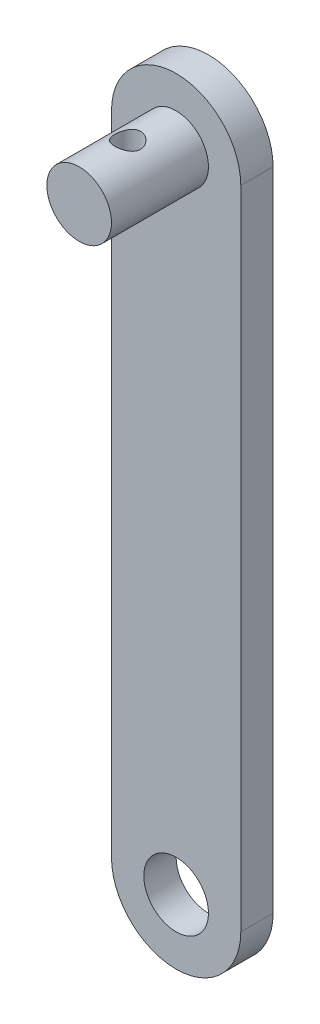
from build123d import *

# Parameters (mm, degrees)
SKETCH1_R           = 6.35
BOSS_EXTRUDE1_DEPTH = 6.35
SKETCH2_R           = 6.35
BOSS_EXTRUDE3_DEPTH = 25.4
SKETCH5_R           = 2.54
CUT_EXTRUDE2_DEPTH  = 82.319677815


with BuildPart() as part:
    # Sketch1 → Boss-Extrude1 (new body)
    with BuildSketch(Plane.XY):
        with BuildLine():
            Line((-12.7, -63.5), (-12.7, 63.5))
            ThreePointArc((-12.7, 63.5), (0, 76.2), (12.7, 63.5))
            Line((12.7, 63.5), (12.7, -63.5))
            ThreePointArc((12.7, -63.5), (0, -76.2), (-12.7, -63.5))
        make_face()
        with Locations((0, 63.5)):
            Circle(SKETCH1_R, mode=Mode.SUBTRACT)
        with Locations(Location((0, -63.5, 0), (0, 0, 180))):
            Circle(SKETCH1_R, mode=Mode.SUBTRACT)
    extrude(amount=BOSS_EXTRUDE1_DEPTH)

    # Sketch2 → Boss-Extrude3 (add)
    with BuildSketch(Plane.XY):
        with Locations((0, 63.5)):
            Circle(SKETCH2_R)
    extrude(amount=BOSS_EXTRUDE3_DEPTH)

    # Sketch5 → Cut-Extrude2 (cut, through all)
    with BuildSketch(Plane(origin=(0, 0, 0), x_dir=(1, 0, 0), z_dir=(0, 1, 0))):
        with Locations(Location((0, -15.875, 0), (0, 0, 90))):
            Circle(SKETCH5_R)
    extrude(amount=CUT_EXTRUDE2_DEPTH, mode=Mode.SUBTRACT)


solid = part.part
